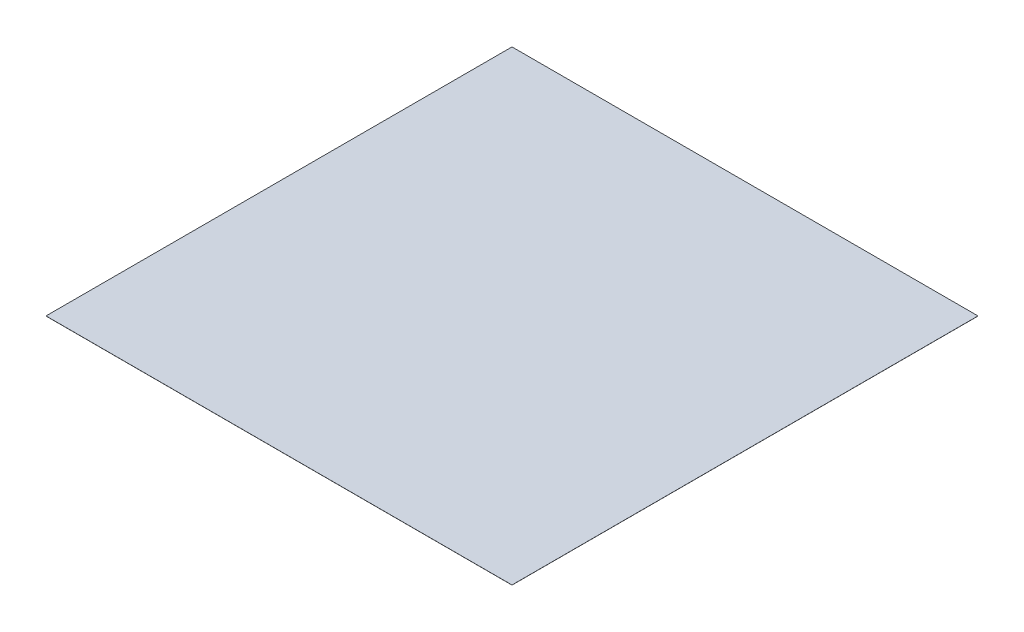
from build123d import *

# Parameters (mm, degrees)
SKETCH_1_W      = 400
SKETCH_1_H      = 400
EXTRUDE_1_DEPTH = 0.05


with BuildPart() as part:
    # 草图1 → 凸台-拉伸1 (new, symmetric)
    with BuildSketch(Plane(origin=(0, 0, 0), x_dir=(1, 0, 0), z_dir=(0, 1, 0))):
        Rectangle(SKETCH_1_W, SKETCH_1_H)
    extrude(amount=EXTRUDE_1_DEPTH, both=True)


solid = part.part
